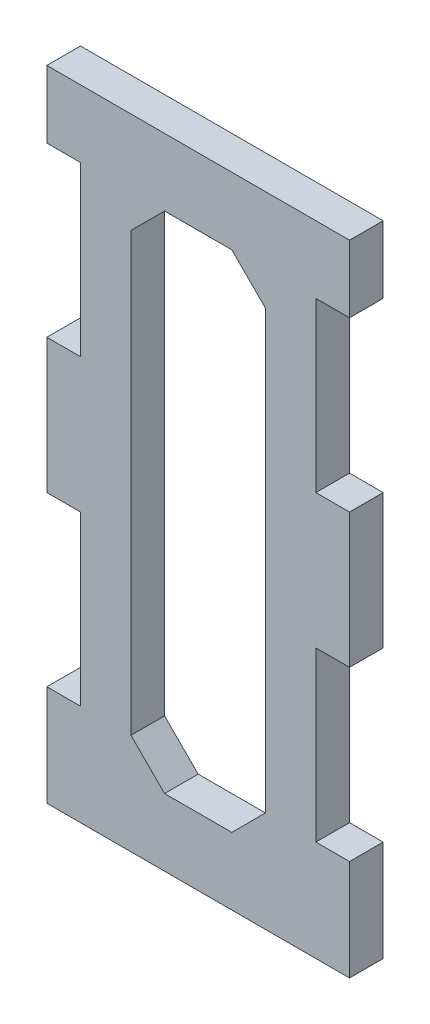
from build123d import *

# Parameters (mm, degrees)
BOSS_EXTRU_1_DEPTH      = 10
ENL_V_MAT_EXTRU_1_DEPTH = 10


with BuildPart() as part:
    # Esquisse1 → Boss.-Extru.1 (new body)
    with BuildSketch(Plane.XY):
        Polygon((0, 0), (90, 0), (90, 30), (80, 30), (80, 80), (90, 80), (90, 120), (80, 120), (80, 170), (90, 170), (90, 190), (0, 190), (0, 170), (10, 170), (10, 120), (0, 120), (0, 80), (10, 80), (10, 30), (0, 30), align=None)
    extrude(amount=BOSS_EXTRU_1_DEPTH)

    # Esquisse2 → Enlèv. mat.-Extru.1 (cut)
    with BuildSketch(Plane.XY.offset(10)):
        Polygon((35, 170), (55, 170), (65, 160), (65, 30), (55, 20), (35, 20), (25, 30), (25, 160), align=None)
    extrude(amount=-ENL_V_MAT_EXTRU_1_DEPTH, mode=Mode.SUBTRACT)


solid = part.part
